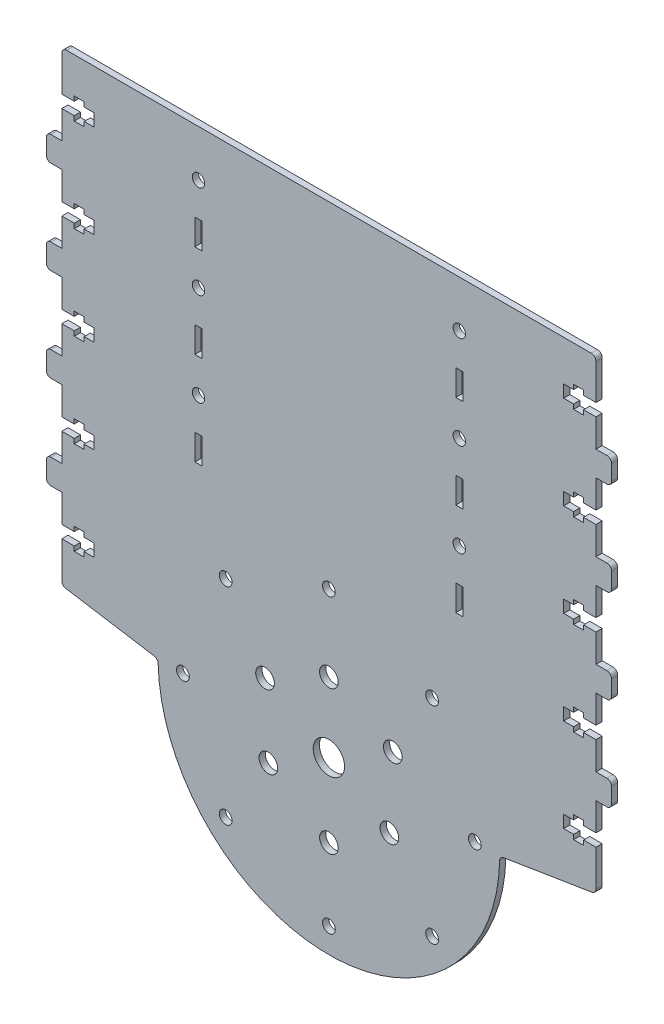
from build123d import *

# Parameters (mm, degrees)
SKETCH_1_R      = 2
SKETCH_1_R_2    = 3
SKETCH_1_R_3    = 5.05
SKETCH_1_R_4    = 2.05
SKETCH_1_W      = 2.3
SKETCH_1_H      = 8.3
EXTRUDE_1_DEPTH = 2
FILLET_1_R      = 1.5


with BuildPart() as part:
    # 草图1 → 凸台-拉伸1 (new body)
    with BuildSketch(Plane.XY):
        with BuildLine():
            Line((143, 46), (147, 46))
            Line((147, 46), (147, 44.5))
            Line((147, 44.5), (150.2, 44.5))
            Line((150.2, 44.5), (150.2, 46))
            Line((150.2, 46), (153.4, 46))
            Line((153.4, 46), (153.4, 50))
            Line((153.4, 50), (150.2, 50))
            Line((150.2, 50), (150.2, 51.5))
            Line((150.2, 51.5), (147, 51.5))
            Line((147, 51.5), (147, 50))
            Line((147, 50), (143, 50))
            Line((143, 50), (143, 59))
            Line((143, 59), (138, 59))
            Line((138, 59), (138, 67))
            Line((138, 67), (143, 67))
            Line((143, 67), (143, 76))
            Line((143, 76), (147, 76))
            Line((147, 76), (147, 74.5))
            Line((147, 74.5), (150.2, 74.5))
            Line((150.2, 74.5), (150.2, 76))
            Line((150.2, 76), (153.4, 76))
            Line((153.4, 76), (153.4, 80))
            Line((153.4, 80), (150.2, 80))
            Line((150.2, 80), (150.2, 81.5))
            Line((150.2, 81.5), (147, 81.5))
            Line((147, 81.5), (147, 80))
            Line((147, 80), (143, 80))
            Line((143, 80), (143, 89))
            Line((143, 89), (138, 89))
            Line((138, 89), (138, 97))
            Line((138, 97), (143, 97))
            Line((143, 97), (143, 106))
            Line((143, 106), (147, 106))
            Line((147, 106), (147, 104.5))
            Line((147, 104.5), (150.2, 104.5))
            Line((150.2, 104.5), (150.2, 106))
            Line((150.2, 106), (153.4, 106))
            Line((153.4, 106), (153.4, 110))
            Line((153.4, 110), (150.2, 110))
            Line((150.2, 110), (150.2, 111.5))
            Line((150.2, 111.5), (147, 111.5))
            Line((147, 111.5), (147, 110))
            Line((147, 110), (143, 110))
            Line((143, 110), (143, 119))
            Line((143, 119), (143, 123))
            Line((143, 123), (315, 123))
            Line((315, 123), (315, 119))
            Line((315, 119), (315, 110))
            Line((315, 110), (311, 110))
            Line((311, 110), (311, 111.5))
            Line((311, 111.5), (307.8, 111.5))
            Line((307.8, 111.5), (307.8, 110))
            Line((307.8, 110), (304.6, 110))
            Line((304.6, 110), (304.6, 106))
            Line((304.6, 106), (307.8, 106))
            Line((307.8, 106), (307.8, 104.5))
            Line((307.8, 104.5), (311, 104.5))
            Line((311, 104.5), (311, 106))
            Line((311, 106), (315, 106))
            Line((315, 106), (315, 97))
            Line((315, 97), (320, 97))
            Line((320, 97), (320, 89))
            Line((320, 89), (315, 89))
            Line((315, 89), (315, 80))
            Line((315, 80), (311, 80))
            Line((311, 80), (311, 81.5))
            Line((311, 81.5), (307.8, 81.5))
            Line((307.8, 81.5), (307.8, 80))
            Line((307.8, 80), (304.6, 80))
            Line((304.6, 80), (304.6, 76))
            Line((304.6, 76), (307.8, 76))
            Line((307.8, 76), (307.8, 74.5))
            Line((307.8, 74.5), (311, 74.5))
            Line((311, 74.5), (311, 76))
            Line((311, 76), (315, 76))
            Line((315, 76), (315, 67))
            Line((315, 67), (320, 67))
            Line((320, 67), (320, 59))
            Line((320, 59), (315, 59))
            Line((315, 59), (315, 50))
            Line((315, 50), (311, 50))
            Line((311, 50), (311, 51.5))
            Line((311, 51.5), (307.8, 51.5))
            Line((307.8, 51.5), (307.8, 50))
            Line((307.8, 50), (304.6, 50))
            Line((304.6, 50), (304.6, 46))
            Line((304.6, 46), (307.8, 46))
            Line((307.8, 46), (307.8, 44.5))
            Line((307.8, 44.5), (311, 44.5))
            Line((311, 44.5), (311, 46))
            Line((311, 46), (315, 46))
            Line((315, 46), (315, 37))
            Line((315, 37), (320, 37))
            Line((320, 37), (320, 29))
            Line((320, 29), (315, 29))
            Line((315, 29), (315, 20))
            Line((315, 20), (311, 20))
            Line((311, 20), (311, 21.5))
            Line((311, 21.5), (307.8, 21.5))
            Line((307.8, 21.5), (307.8, 20))
            Line((307.8, 20), (304.6, 20))
            Line((304.6, 20), (304.6, 16))
            Line((304.6, 16), (307.8, 16))
            Line((307.8, 16), (307.8, 14.5))
            Line((307.8, 14.5), (311, 14.5))
            Line((311, 14.5), (311, 16))
            Line((311, 16), (315, 16))
            Line((315, 16), (315, 7))
            Line((315, 7), (320, 7))
            Line((320, 7), (320, -1))
            Line((320, -1), (315, -1))
            Line((315, -1), (315, -10))
            Line((315, -10), (311, -10))
            Line((311, -10), (311, -8.5))
            Line((311, -8.5), (307.8, -8.5))
            Line((307.8, -8.5), (307.8, -10))
            Line((307.8, -10), (304.6, -10))
            Line((304.6, -10), (304.6, -14))
            Line((304.6, -14), (307.8, -14))
            Line((307.8, -14), (307.8, -15.5))
            Line((307.8, -15.5), (311, -15.5))
            Line((311, -15.5), (311, -14))
            Line((311, -14), (315, -14))
            Line((315, -14), (315, -27))
            Line((315, -27), (284, -32))
            ThreePointArc((284, -32), (229, -87), (174, -32))
            Line((174, -32), (143, -27))
            Line((143, -27), (143, -14))
            Line((143, -14), (147, -14))
            Line((147, -14), (147, -15.5))
            Line((147, -15.5), (150.2, -15.5))
            Line((150.2, -15.5), (150.2, -14))
            Line((150.2, -14), (153.4, -14))
            Line((153.4, -14), (153.4, -10))
            Line((153.4, -10), (150.2, -10))
            Line((150.2, -10), (150.2, -8.5))
            Line((150.2, -8.5), (147, -8.5))
            Line((147, -8.5), (147, -10))
            Line((147, -10), (143, -10))
            Line((143, -10), (143, -1))
            Line((143, -1), (138, -1))
            Line((138, -1), (138, 7))
            Line((138, 7), (143, 7))
            Line((143, 7), (143, 16))
            Line((143, 16), (147, 16))
            Line((147, 16), (147, 14.5))
            Line((147, 14.5), (150.2, 14.5))
            Line((150.2, 14.5), (150.2, 16))
            Line((150.2, 16), (153.4, 16))
            Line((153.4, 16), (153.4, 20))
            Line((153.4, 20), (150.2, 20))
            Line((150.2, 20), (150.2, 21.5))
            Line((150.2, 21.5), (147, 21.5))
            Line((147, 21.5), (147, 20))
            Line((147, 20), (143, 20))
            Line((143, 20), (143, 29))
            Line((143, 29), (138, 29))
            Line((138, 29), (138, 37))
            Line((138, 37), (143, 37))
            Line((143, 37), (143, 46))
        make_face()
        with Locations((187, 108)):
            Circle(SKETCH_1_R, mode=Mode.SUBTRACT)
        with Locations((229, -55.75)):
            Circle(SKETCH_1_R_2, mode=Mode.SUBTRACT)
        with Locations((248.485571585, -43.25)):
            Circle(SKETCH_1_R_2, mode=Mode.SUBTRACT)
        with Locations((229, -32)):
            Circle(SKETCH_1_R_3, mode=Mode.SUBTRACT)
        with Locations((276, -32)):
            Circle(SKETCH_1_R_4, mode=Mode.SUBTRACT)
        with Locations((208.43189666, -20.125)):
            Circle(SKETCH_1_R_2, mode=Mode.SUBTRACT)
        with Locations((249.56810334, -20.125)):
            Circle(SKETCH_1_R_2, mode=Mode.SUBTRACT)
        with Locations((209.514428415, -43.25)):
            Circle(SKETCH_1_R_2, mode=Mode.SUBTRACT)
        with Locations((229, -9.5)):
            Circle(SKETCH_1_R_2, mode=Mode.SUBTRACT)
        with Locations((187, 78)):
            Circle(SKETCH_1_R, mode=Mode.SUBTRACT)
        with Locations((187, 48)):
            Circle(SKETCH_1_R, mode=Mode.SUBTRACT)
        with Locations((262.234018716, -65.234018716)):
            Circle(SKETCH_1_R_4, mode=Mode.SUBTRACT)
        with Locations((229, -79)):
            Circle(SKETCH_1_R_4, mode=Mode.SUBTRACT)
        with Locations((195.765981284, -65.234018716)):
            Circle(SKETCH_1_R_4, mode=Mode.SUBTRACT)
        with Locations((182, -32)):
            Circle(SKETCH_1_R_4, mode=Mode.SUBTRACT)
        with Locations((195.765981284, 1.234018716)):
            Circle(SKETCH_1_R_4, mode=Mode.SUBTRACT)
        with Locations((229, 15)):
            Circle(SKETCH_1_R_4, mode=Mode.SUBTRACT)
        with Locations((262.234018716, 1.234018716)):
            Circle(SKETCH_1_R_4, mode=Mode.SUBTRACT)
        with Locations((271, 48)):
            Circle(SKETCH_1_R, mode=Mode.SUBTRACT)
        with Locations((271, 78)):
            Circle(SKETCH_1_R, mode=Mode.SUBTRACT)
        with Locations((271, 108)):
            Circle(SKETCH_1_R, mode=Mode.SUBTRACT)
        with Locations((271, 33)):
            Rectangle(SKETCH_1_W, SKETCH_1_H, mode=Mode.SUBTRACT)
        with Locations((271, 63)):
            Rectangle(SKETCH_1_W, SKETCH_1_H, mode=Mode.SUBTRACT)
        with Locations((271, 93)):
            Rectangle(SKETCH_1_W, SKETCH_1_H, mode=Mode.SUBTRACT)
        with Locations((187, 93)):
            Rectangle(SKETCH_1_W, SKETCH_1_H, mode=Mode.SUBTRACT)
        with Locations((187, 63)):
            Rectangle(SKETCH_1_W, SKETCH_1_H, mode=Mode.SUBTRACT)
        with Locations((187, 33)):
            Rectangle(SKETCH_1_W, SKETCH_1_H, mode=Mode.SUBTRACT)
    extrude(amount=EXTRUDE_1_DEPTH)

    # 圆角1
    fillet_1_edges = [part.edges().sort_by_distance(p)[0] for p in [
        (143, -27, 1),
        (138, -1, 1),
        (138, 7, 1),
        (138, 29, 1),
        (138, 37, 1),
        (138, 59, 1),
        (138, 67, 1),
        (138, 89, 1),
        (138, 97, 1),
        (143, 123, 1),
        (315, 123, 1),
        (320, 97, 1),
        (320, 89, 1),
        (320, 67, 1),
        (320, 59, 1),
        (320, 37, 1),
        (320, 29, 1),
        (320, 7, 1),
        (320, -1, 1),
        (315, -27, 1),
        (284, -32, 1),
        (174, -32, 1),
    ]]
    fillet(fillet_1_edges, radius=FILLET_1_R)


solid = part.part
